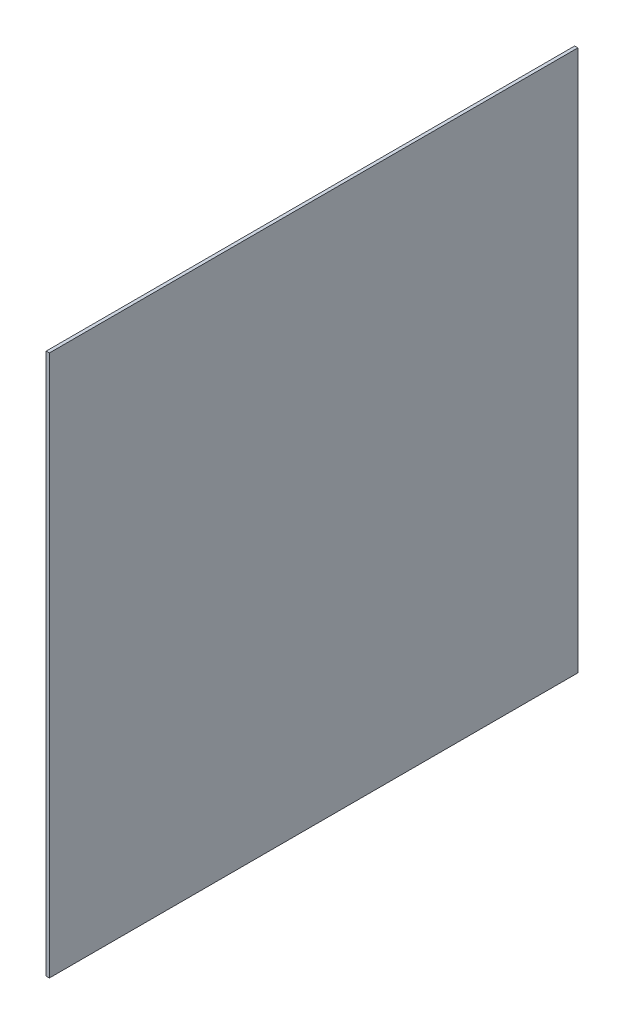
from build123d import *

# Parameters (mm, degrees)
SKETCH1_W           = 2082.8
SKETCH1_H           = 2133.6
BOSS_EXTRUDE1_DEPTH = 12.7


with BuildPart() as part:
    # Sketch1 → Boss-Extrude1 (new body)
    with BuildSketch(Plane(origin=(0, 0, 0), x_dir=(0, 0, -1), z_dir=(1, 0, 0))):
        with Locations((1041.4, 1066.8)):
            Rectangle(SKETCH1_W, SKETCH1_H)
    extrude(amount=BOSS_EXTRUDE1_DEPTH)


solid = part.part
